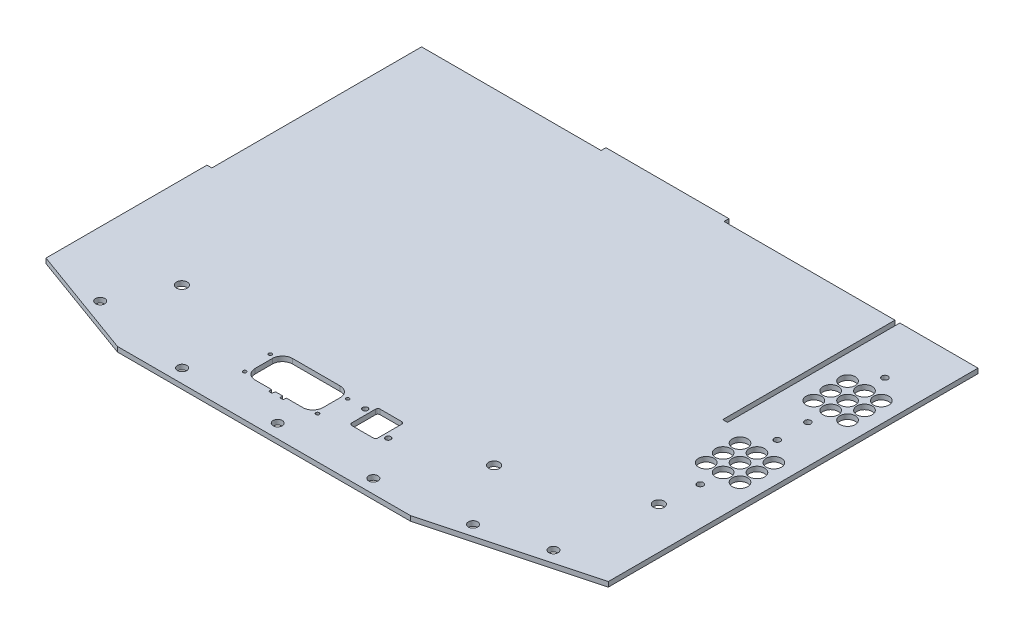
from build123d import *

# Parameters (mm, degrees)
SKETCH1_W                 = 308.11216
SKETCH1_H                 = 3.175
BOSS_EXTRUDE1_DEPTH       = 267.83
SKETCH3_W                 = 155.702
SKETCH3_H                 = 3.175
BOSS_EXTRUDE3_DEPTH       = 3.175
SKETCH4_W                 = 50.87366
SKETCH4_H                 = 3.175
BOSS_EXTRUDE4_DEPTH       = 267.83
CUT_EXTRUDE1_DEPTH        = 340.191055801
CUT_EXTRUDE3_DEPTH        = 340.191055801
SKETCH19_R                = 5
CUT_EXTRUDE5_DEPTH        = 340.191055801
LPATTERN1_COUNT           = 3
LPATTERN1_PITCH           = 11
LPATTERN2_COUNT           = 3
LPATTERN2_PITCH           = 11
LPATTERN2_COPY_1_SKETCH_R = 5
LPATTERN2_COPY_1_DEPTH    = 340.191055801
LPATTERN2_COPY_2_SKETCH_R = 5
LPATTERN2_COPY_2_DEPTH    = 340.191055801
LPATTERN2_COPY_3_SKETCH_R = 5
LPATTERN2_COPY_3_DEPTH    = 340.191055801
LPATTERN2_COPY_4_SKETCH_R = 5
LPATTERN2_COPY_4_DEPTH    = 340.191055801
LPATTERN3_COUNT           = 2
LPATTERN3_PITCH           = 69.999939878
LPATTERN3_COPY_1_SKETCH_R = 5
LPATTERN3_COPY_1_DEPTH    = 340.191055801
LPATTERN3_COPY_2_SKETCH_R = 5
LPATTERN3_COPY_2_DEPTH    = 340.191055801
LPATTERN3_COPY_3_SKETCH_R = 5
LPATTERN3_COPY_3_DEPTH    = 340.191055801
LPATTERN3_COPY_4_SKETCH_R = 5
LPATTERN3_COPY_4_DEPTH    = 340.191055801
LPATTERN3_COPY_5_SKETCH_R = 5
LPATTERN3_COPY_5_DEPTH    = 340.191055801
LPATTERN3_COPY_6_SKETCH_R = 5
LPATTERN3_COPY_6_DEPTH    = 340.191055801
LPATTERN3_COPY_7_SKETCH_R = 5
LPATTERN3_COPY_7_DEPTH    = 340.191055801
LPATTERN3_COPY_8_SKETCH_R = 5
LPATTERN3_COPY_8_DEPTH    = 340.191055801
SKETCH21_W                = 105.9343525
SKETCH21_H                = 3.175
BOSS_EXTRUDE5_DEPTH       = 3.175
CUT_EXTRUDE9_DEPTH        = 340.191055801
CUT_EXTRUDE9_DEPTH_BACK   = 340.191055801
CUT_EXTRUDE11_DEPTH       = 340.191055801
CUT_EXTRUDE11_DEPTH_BACK  = 80.645
SKETCH32_R                = 3
M6_CLEARANCE_HOLE1_D      = 7
M6_CLEARANCE_HOLE2_D      = 7
CUT_EXTRUDE12_DEPTH       = 340.191055801
M3_CLEARANCE_HOLE1_D      = 3.4
SKETCH42_R                = 2
CUT_EXTRUDE13_DEPTH       = 340.191055942
SKETCH43_W                = 80
SKETCH43_H                = 3.175
BOSS_EXTRUDE6_DEPTH       = 3.175


with BuildPart() as part:
    # Sketch1 → Boss-Extrude1 (new body)
    with BuildSketch(Plane.XY):
        Rectangle(SKETCH1_W, SKETCH1_H)
    extrude(amount=BOSS_EXTRUDE1_DEPTH)

    # Sketch3 → Boss-Extrude3 (add)
    with BuildSketch(Plane(origin=(154.05608, 0, 0), x_dir=(0, 0, -1), z_dir=(1, 0, 0))):
        with Locations((-189.979, 0)):
            Rectangle(SKETCH3_W, SKETCH3_H)
    extrude(amount=BOSS_EXTRUDE3_DEPTH)

    # Sketch4 → Boss-Extrude4 (add)
    with BuildSketch(Plane.XY.offset(267.83)):
        with Locations((182.66791, 0)):
            Rectangle(SKETCH4_W, SKETCH4_H)
    extrude(amount=-BOSS_EXTRUDE4_DEPTH)

    # Sketch6 → Cut-Extrude1 (cut, through all)
    with BuildSketch(Plane(origin=(0, 1.5875, 0), x_dir=(1, 0, 0), z_dir=(0, 1, 0))):
        Polygon((208.10474, -240.606362049), (106.50474, -267.83), (208.10474, -267.83), align=None)
    extrude(amount=-CUT_EXTRUDE1_DEPTH, mode=Mode.SUBTRACT)

    # Sketch11 → Cut-Extrude3 (cut, through all)
    with BuildSketch(Plane.XZ.offset(1.5875)):
        Polygon((-154.05608, 242.43), (-84.20608, 267.83), (-154.05608, 267.83), align=None)
    extrude(amount=-CUT_EXTRUDE3_DEPTH, mode=Mode.SUBTRACT)

    # Sketch19 → Cut-Extrude5 (cut, through all)
    with BuildSketch(Plane(origin=(0, 1.5875, 0), x_dir=(1, 0, 0), z_dir=(0, 1, 0))):
        with Locations(Location((172.98674, -49.774823778, 0), (0, 0, 270))):
            Circle(SKETCH19_R)
    cut_extrude5 = extrude(amount=-CUT_EXTRUDE5_DEPTH, mode=Mode.SUBTRACT)

    # LPattern1: Cut-Extrude5 ×3
    with Locations(*[(i * LPATTERN1_PITCH, 0, 0) for i in range(1, LPATTERN1_COUNT)]):
        add(cut_extrude5, mode=Mode.SUBTRACT)

    # LPattern2: Cut-Extrude5 ×3
    with Locations(*[(0, 0, i * LPATTERN2_PITCH) for i in range(1, LPATTERN2_COUNT)]):
        add(cut_extrude5, mode=Mode.SUBTRACT)

    # LPattern2 copy 1 sketch → LPattern2 copy 1 (cut, through all)
    with BuildSketch(Plane(origin=(11, 1.5875, 11), x_dir=(1, 0, 0), z_dir=(0, 1, 0))):
        with Locations(Location((172.98674, -49.774823778, 0), (0, 0, 270))):
            Circle(LPATTERN2_COPY_1_SKETCH_R)
    extrude(amount=-LPATTERN2_COPY_1_DEPTH, mode=Mode.SUBTRACT)

    # LPattern2 copy 2 sketch → LPattern2 copy 2 (cut, through all)
    with BuildSketch(Plane(origin=(11, 1.5875, 22), x_dir=(1, 0, 0), z_dir=(0, 1, 0))):
        with Locations(Location((172.98674, -49.774823778, 0), (0, 0, 270))):
            Circle(LPATTERN2_COPY_2_SKETCH_R)
    extrude(amount=-LPATTERN2_COPY_2_DEPTH, mode=Mode.SUBTRACT)

    # LPattern2 copy 3 sketch → LPattern2 copy 3 (cut, through all)
    with BuildSketch(Plane(origin=(22, 1.5875, 11), x_dir=(1, 0, 0), z_dir=(0, 1, 0))):
        with Locations(Location((172.98674, -49.774823778, 0), (0, 0, 270))):
            Circle(LPATTERN2_COPY_3_SKETCH_R)
    extrude(amount=-LPATTERN2_COPY_3_DEPTH, mode=Mode.SUBTRACT)

    # LPattern2 copy 4 sketch → LPattern2 copy 4 (cut, through all)
    with BuildSketch(Plane(origin=(22, 1.5875, 22), x_dir=(1, 0, 0), z_dir=(0, 1, 0))):
        with Locations(Location((172.98674, -49.774823778, 0), (0, 0, 270))):
            Circle(LPATTERN2_COPY_4_SKETCH_R)
    extrude(amount=-LPATTERN2_COPY_4_DEPTH, mode=Mode.SUBTRACT)

    # LPattern3: Cut-Extrude5 ×2
    with Locations(*[(0, 0, i * LPATTERN3_PITCH) for i in range(1, LPATTERN3_COUNT)]):
        add(cut_extrude5, mode=Mode.SUBTRACT)

    # LPattern3 copy 1 sketch → LPattern3 copy 1 (cut, through all)
    with BuildSketch(Plane(origin=(11, 1.5875, 69.999939878), x_dir=(1, 0, 0), z_dir=(0, 1, 0))):
        with Locations(Location((172.98674, -49.774823778, 0), (0, 0, 270))):
            Circle(LPATTERN3_COPY_1_SKETCH_R)
    extrude(amount=-LPATTERN3_COPY_1_DEPTH, mode=Mode.SUBTRACT)

    # LPattern3 copy 2 sketch → LPattern3 copy 2 (cut, through all)
    with BuildSketch(Plane(origin=(22, 1.5875, 69.999939878), x_dir=(1, 0, 0), z_dir=(0, 1, 0))):
        with Locations(Location((172.98674, -49.774823778, 0), (0, 0, 270))):
            Circle(LPATTERN3_COPY_2_SKETCH_R)
    extrude(amount=-LPATTERN3_COPY_2_DEPTH, mode=Mode.SUBTRACT)

    # LPattern3 copy 3 sketch → LPattern3 copy 3 (cut, through all)
    with BuildSketch(Plane(origin=(0, 1.5875, 80.999939878), x_dir=(1, 0, 0), z_dir=(0, 1, 0))):
        with Locations(Location((172.98674, -49.774823778, 0), (0, 0, 270))):
            Circle(LPATTERN3_COPY_3_SKETCH_R)
    extrude(amount=-LPATTERN3_COPY_3_DEPTH, mode=Mode.SUBTRACT)

    # LPattern3 copy 4 sketch → LPattern3 copy 4 (cut, through all)
    with BuildSketch(Plane(origin=(0, 1.5875, 91.999939878), x_dir=(1, 0, 0), z_dir=(0, 1, 0))):
        with Locations(Location((172.98674, -49.774823778, 0), (0, 0, 270))):
            Circle(LPATTERN3_COPY_4_SKETCH_R)
    extrude(amount=-LPATTERN3_COPY_4_DEPTH, mode=Mode.SUBTRACT)

    # LPattern3 copy 5 sketch → LPattern3 copy 5 (cut, through all)
    with BuildSketch(Plane(origin=(11, 1.5875, 80.999939878), x_dir=(1, 0, 0), z_dir=(0, 1, 0))):
        with Locations(Location((172.98674, -49.774823778, 0), (0, 0, 270))):
            Circle(LPATTERN3_COPY_5_SKETCH_R)
    extrude(amount=-LPATTERN3_COPY_5_DEPTH, mode=Mode.SUBTRACT)

    # LPattern3 copy 6 sketch → LPattern3 copy 6 (cut, through all)
    with BuildSketch(Plane(origin=(11, 1.5875, 91.999939878), x_dir=(1, 0, 0), z_dir=(0, 1, 0))):
        with Locations(Location((172.98674, -49.774823778, 0), (0, 0, 270))):
            Circle(LPATTERN3_COPY_6_SKETCH_R)
    extrude(amount=-LPATTERN3_COPY_6_DEPTH, mode=Mode.SUBTRACT)

    # LPattern3 copy 7 sketch → LPattern3 copy 7 (cut, through all)
    with BuildSketch(Plane(origin=(22, 1.5875, 80.999939878), x_dir=(1, 0, 0), z_dir=(0, 1, 0))):
        with Locations(Location((172.98674, -49.774823778, 0), (0, 0, 270))):
            Circle(LPATTERN3_COPY_7_SKETCH_R)
    extrude(amount=-LPATTERN3_COPY_7_DEPTH, mode=Mode.SUBTRACT)

    # LPattern3 copy 8 sketch → LPattern3 copy 8 (cut, through all)
    with BuildSketch(Plane(origin=(22, 1.5875, 91.999939878), x_dir=(1, 0, 0), z_dir=(0, 1, 0))):
        with Locations(Location((172.98674, -49.774823778, 0), (0, 0, 270))):
            Circle(LPATTERN3_COPY_8_SKETCH_R)
    extrude(amount=-LPATTERN3_COPY_8_DEPTH, mode=Mode.SUBTRACT)

    # Sketch21 → Boss-Extrude5 (add)
    with BuildSketch(Plane.ZY.offset(154.05608)):
        with Locations((189.46282375, 0)):
            Rectangle(SKETCH21_W, SKETCH21_H)
    extrude(amount=BOSS_EXTRUDE5_DEPTH)

    # Sketch27 → Cut-Extrude9 (cut, two sides: drawn at the far end of the back side and taken through both)
    with BuildSketch(Plane(origin=(0, 1.5875, 0), x_dir=(1, 0, 0), z_dir=(0, 1, 0)).offset(-CUT_EXTRUDE9_DEPTH_BACK)):
        Polygon((748.107746333, -570.489573212), (-84.20608, -267.83), (-154.05608, -242.43), (-157.23108, -241.275454545), (-989.544906333, 61.384118666), (-1594.864052757, -1603.243534), (142.788599909, -2235.117225879), align=None)
    extrude(amount=CUT_EXTRUDE9_DEPTH + CUT_EXTRUDE9_DEPTH_BACK, mode=Mode.SUBTRACT)

    # Sketch32 → Cut-Extrude11 (cut, two sides: drawn at the far end of the back side and taken through both)
    with BuildSketch(Plane(origin=(0, 1.5875, 0), x_dir=(1, 0, 0), z_dir=(0, 1, 0)).offset(-CUT_EXTRUDE11_DEPTH_BACK)):
        with Locations(Location((172.54426, -240.761310541, 0), (0, 0, 90))):
            Circle(SKETCH32_R)
        with Locations(Location((131.90426, -252.445254824, 0), (0, 0, 90))):
            Circle(SKETCH32_R)
        with Locations(Location((73.48426, -258.94, 0), (0, 0, 90))):
            Circle(SKETCH32_R)
        with Locations(Location((11.25426, -258.94, 0), (0, 0, 90))):
            Circle(SKETCH32_R)
        with Locations(Location((-50.97574, -258.94, 0), (0, 0, 90))):
            Circle(SKETCH32_R)
        with Locations(Location((-115.3206, -247.915394364, 0), (0, 0, 90))):
            Circle(SKETCH32_R)
    extrude(amount=CUT_EXTRUDE11_DEPTH + CUT_EXTRUDE11_DEPTH_BACK, mode=Mode.SUBTRACT)

    # M6 Clearance Hole1 (through all)
    with Locations(Plane(origin=(0, 1.5875, 0), x_dir=(1, 0, 0), z_dir=(0, 1, 0))):
        with Locations((180.96500002, -180.586)):
            Hole(M6_CLEARANCE_HOLE1_D / 2)

    # M6 Clearance Hole2 (through all)
    with Locations(Plane(origin=(0, 1.5875, 0), x_dir=(1, 0, 0), z_dir=(0, 1, 0))):
        with Locations((105.42905, -212.2849914), (-97.77095, -212.2849914)):
            Hole(M6_CLEARANCE_HOLE2_D / 2)

    # Sketch36 → Cut-Extrude12 (cut, through all)
    # profile 1 of 11: a face of its own
    with BuildSketch(Plane(origin=(0, 1.5875, 0), x_dir=(1, 0, 0), z_dir=(0, 1, 0))):
        with BuildLine():
            Line((-0.218637999, -243.976806196), (-0.043660718, -241.976806026))
            Line((-0.043660718, -241.976806026), (10.607217094, -241.976806026))
            ThreePointArc((10.607217094, -241.976806026), (15.260686821, -240.049275753), (17.188217094, -235.395806026))
            Line((17.188217094, -235.395806026), (17.188217094, -224.195806026))
            ThreePointArc((17.188217094, -224.195806026), (15.260686821, -219.542336299), (10.607217094, -217.614806026))
            Line((10.607217094, -217.614806026), (-20.392782906, -217.614806026))
            ThreePointArc((-20.392782906, -217.614806026), (-25.046252633, -219.542336299), (-26.973782906, -224.195806026))
            Line((-26.973782906, -224.195806026), (-26.973782906, -235.395806026))
            ThreePointArc((-26.973782906, -235.395806026), (-25.046252633, -240.049275753), (-20.392782906, -241.976806026))
            Line((-20.392782906, -241.976806026), (-9.741905078, -241.976806026))
            Line((-9.741905078, -241.976806026), (-9.566927704, -243.976806196))
            Line((-9.566927704, -243.976806196), (-7.418637999, -243.976806196))
            Line((-7.418637999, -243.976806196), (-7.243660718, -241.976806026))
            Line((-7.243660718, -241.976806026), (-2.541905078, -241.976806026))
            Line((-2.541905078, -241.976806026), (-2.366927704, -243.976806196))
            Line((-2.366927704, -243.976806196), (-0.218637999, -243.976806196))
        make_face()
        with BuildLine():
            Line((10.607217094, -241.595806026), (-0.392782906, -241.595806026))
            Line((-0.392782906, -241.595806026), (-0.567760187, -243.595806196))
            Line((-0.567760187, -243.595806196), (-2.017805533, -243.595806196))
            Line((-2.017805533, -243.595806196), (-2.192782906, -241.595806026))
            Line((-2.192782906, -241.595806026), (-7.592782906, -241.595806026))
            Line((-7.592782906, -241.595806026), (-7.767760187, -243.595806196))
            Line((-7.767760187, -243.595806196), (-9.217805533, -243.595806196))
            Line((-9.217805533, -243.595806196), (-9.392782906, -241.595806026))
            Line((-9.392782906, -241.595806026), (-20.392782906, -241.595806026))
            ThreePointArc((-20.392782906, -241.595806026), (-24.77684495, -239.779868069), (-26.592782906, -235.395806026))
            Line((-26.592782906, -235.395806026), (-26.592782906, -224.195806026))
            ThreePointArc((-26.592782906, -224.195806026), (-24.77684495, -219.811743982), (-20.392782906, -217.995806026))
            Line((-20.392782906, -217.995806026), (10.607217094, -217.995806026))
            ThreePointArc((10.607217094, -217.995806026), (14.991279137, -219.811743982), (16.807217094, -224.195806026))
            Line((16.807217094, -224.195806026), (16.807217094, -235.395806026))
            ThreePointArc((16.807217094, -235.395806026), (14.991279137, -239.779868069), (10.607217094, -241.595806026))
        make_face(mode=Mode.SUBTRACT)
    # profile 2 of 11: a face of its own
    with BuildSketch(Plane(origin=(0, 1.5875, 0), x_dir=(1, 0, 0), z_dir=(0, 1, 0))):
        Polygon((-7.767760187, -243.595806196), (-7.592782906, -241.595806026), (-9.392782906, -241.595806026), (-9.217805533, -243.595806196), align=None)
    # profile 3 of 11: a face of its own
    with BuildSketch(Plane(origin=(0, 1.5875, 0), x_dir=(1, 0, 0), z_dir=(0, 1, 0))):
        Polygon((-0.567760187, -243.595806196), (-0.392782906, -241.595806026), (-2.192782906, -241.595806026), (-2.017805533, -243.595806196), align=None)
    # profile 4 of 11: a face of its own
    with BuildSketch(Plane(origin=(0, 1.5875, 0), x_dir=(1, 0, 0), z_dir=(0, 1, 0))):
        with BuildLine():
            Line((-2.192782906, -241.595806026), (-0.392782906, -241.595806026))
            Line((-0.392782906, -241.595806026), (10.607217094, -241.595806026))
            ThreePointArc((10.607217094, -241.595806026), (14.991279137, -239.779868069), (16.807217094, -235.395806026))
            Line((16.807217094, -235.395806026), (16.807217094, -224.195806026))
            ThreePointArc((16.807217094, -224.195806026), (14.991279137, -219.811743982), (10.607217094, -217.995806026))
            Line((10.607217094, -217.995806026), (-20.392782906, -217.995806026))
            ThreePointArc((-20.392782906, -217.995806026), (-24.77684495, -219.811743982), (-26.592782906, -224.195806026))
            Line((-26.592782906, -224.195806026), (-26.592782906, -235.395806026))
            ThreePointArc((-26.592782906, -235.395806026), (-24.77684495, -239.779868069), (-20.392782906, -241.595806026))
            Line((-20.392782906, -241.595806026), (-9.392782906, -241.595806026))
            Line((-9.392782906, -241.595806026), (-7.592782906, -241.595806026))
            Line((-7.592782906, -241.595806026), (-2.192782906, -241.595806026))
        make_face()
    # profile 5 of 11: a face of its own
    with BuildSketch(Plane(origin=(0, 1.5875, 0), x_dir=(1, 0, 0), z_dir=(0, 1, 0))):
        with BuildLine():
            add(Edge.make_bspline(
                [(50.704288123, -236.196811977), (50.889280377, -236.196811977), (51.251028279, -236.133180028), (51.784098786, -235.795622639), (52.121656175, -235.262552133), (52.185288123, -234.90080423), (52.185288123, -234.715811977)],
                knots=[0, 0, 0, 0, 0.25, 0.5, 0.75, 1, 1, 1, 1], degree=3))
            Line((52.185288123, -234.715811977), (52.185288123, -219.165811977))
            add(Edge.make_bspline(
                [(52.185288123, -219.165811977), (52.185288123, -218.980819723), (52.121656175, -218.619071821), (51.784098786, -218.086001314), (51.251028279, -217.748443925), (50.889280377, -217.684811977), (50.704288123, -217.684811977)],
                knots=[0, 0, 0, 0, 0.25, 0.5, 0.75, 1, 1, 1, 1], degree=3))
            Line((50.704288123, -217.684811977), (36.654288123, -217.684811977))
            add(Edge.make_bspline(
                [(36.654288123, -217.684811977), (36.46929587, -217.684811977), (36.107547967, -217.748443925), (35.574477461, -218.086001314), (35.236920072, -218.619071821), (35.173288123, -218.980819723), (35.173288123, -219.165811977)],
                knots=[0, 0, 0, 0, 0.25, 0.5, 0.75, 1, 1, 1, 1], degree=3))
            Line((35.173288123, -219.165811977), (35.173288123, -234.715811977))
            add(Edge.make_bspline(
                [(35.173288123, -234.715811977), (35.173288123, -234.90080423), (35.236920072, -235.262552133), (35.574477461, -235.795622639), (36.107547967, -236.133180028), (36.46929587, -236.196811977), (36.654288123, -236.196811977)],
                knots=[0, 0, 0, 0, 0.25, 0.5, 0.75, 1, 1, 1, 1], degree=3))
            Line((36.654288123, -236.196811977), (50.704288123, -236.196811977))
        make_face()
        with BuildLine():
            Line((36.654288123, -218.065811977), (50.704288123, -218.065811977))
            add(Edge.make_bspline(
                [(51.804288123, -219.165811977), (51.804288123, -218.521446895), (51.348653205, -218.065811977), (50.704288123, -218.065811977)],
                knots=[0, 0, 0, 0, 1, 1, 1, 1], degree=3, weights=[1, 0.804737854, 0.804737854, 1]))
            Line((51.804288123, -219.165811977), (51.804288123, -234.715811977))
            add(Edge.make_bspline(
                [(50.704288123, -235.815811977), (51.348653205, -235.815811977), (51.804288123, -235.360177058), (51.804288123, -234.715811977)],
                knots=[0, 0, 0, 0, 1, 1, 1, 1], degree=3, weights=[1, 0.804737854, 0.804737854, 1]))
            Line((50.704288123, -235.815811977), (36.654288123, -235.815811977))
            add(Edge.make_bspline(
                [(35.554288123, -234.715811977), (35.554288123, -235.360177058), (36.009923042, -235.815811977), (36.654288123, -235.815811977)],
                knots=[0, 0, 0, 0, 1, 1, 1, 1], degree=3, weights=[1, 0.804737854, 0.804737854, 1]))
            Line((35.554288123, -234.715811977), (35.554288123, -219.165811977))
            add(Edge.make_bspline(
                [(36.654288123, -218.065811977), (36.009923042, -218.065811977), (35.554288123, -218.521446895), (35.554288123, -219.165811977)],
                knots=[0, 0, 0, 0, 1, 1, 1, 1], degree=3, weights=[1, 0.804737854, 0.804737854, 1]))
        make_face(mode=Mode.SUBTRACT)
    # profile 6 of 11: a face of its own
    with BuildSketch(Plane(origin=(0, 1.5875, 0), x_dir=(1, 0, 0), z_dir=(0, 1, 0))):
        with BuildLine():
            add(Edge.make_bspline(
                [(51.804288123, -219.165811977), (51.804288123, -218.521446895), (51.348653205, -218.065811977), (50.704288123, -218.065811977)],
                knots=[0, 0, 0, 0, 1, 1, 1, 1], degree=3, weights=[1, 0.804737854, 0.804737854, 1]))
            Line((50.704288123, -218.065811977), (36.654288123, -218.065811977))
            add(Edge.make_bspline(
                [(36.654288123, -218.065811977), (36.009923042, -218.065811977), (35.554288123, -218.521446895), (35.554288123, -219.165811977)],
                knots=[0, 0, 0, 0, 1, 1, 1, 1], degree=3, weights=[1, 0.804737854, 0.804737854, 1]))
            Line((35.554288123, -219.165811977), (35.554288123, -234.715811977))
            add(Edge.make_bspline(
                [(35.554288123, -234.715811977), (35.554288123, -235.360177058), (36.009923042, -235.815811977), (36.654288123, -235.815811977)],
                knots=[0, 0, 0, 0, 1, 1, 1, 1], degree=3, weights=[1, 0.804737854, 0.804737854, 1]))
            Line((36.654288123, -235.815811977), (50.704288123, -235.815811977))
            add(Edge.make_bspline(
                [(50.704288123, -235.815811977), (51.348653205, -235.815811977), (51.804288123, -235.360177058), (51.804288123, -234.715811977)],
                knots=[0, 0, 0, 0, 1, 1, 1, 1], degree=3, weights=[1, 0.804737854, 0.804737854, 1]))
            Line((51.804288123, -234.715811977), (51.804288123, -219.165811977))
        make_face()
        with BuildLine():
            add(Edge.make_bspline(
                [(36.204288116, -219.165811977), (36.204288116, -218.90220808), (36.390684219, -218.715811977), (36.654288116, -218.715811977)],
                knots=[0, 0, 0, 0, 1, 1, 1, 1], degree=3, weights=[1, 0.804737854, 0.804737854, 1]))
            Line((36.654288116, -218.715811977), (50.704288116, -218.715811977))
            add(Edge.make_bspline(
                [(50.704288116, -218.715811977), (50.967892012, -218.715811977), (51.154288116, -218.90220808), (51.154288116, -219.165811977)],
                knots=[0, 0, 0, 0, 1, 1, 1, 1], degree=3, weights=[1, 0.804737854, 0.804737854, 1]))
            Line((51.154288116, -219.165811977), (51.154288116, -234.715811977))
            add(Edge.make_bspline(
                [(51.154288116, -234.715811977), (51.154288116, -234.979415874), (50.967892012, -235.165811977), (50.704288116, -235.165811977)],
                knots=[0, 0, 0, 0, 1, 1, 1, 1], degree=3, weights=[1, 0.804737854, 0.804737854, 1]))
            Line((50.704288116, -235.165811977), (36.654288116, -235.165811977))
            add(Edge.make_bspline(
                [(36.654288116, -235.165811977), (36.390684219, -235.165811977), (36.204288116, -234.979415874), (36.204288116, -234.715811977)],
                knots=[0, 0, 0, 0, 1, 1, 1, 1], degree=3, weights=[1, 0.804737854, 0.804737854, 1]))
            Line((36.204288116, -234.715811977), (36.204288116, -219.165811977))
        make_face(mode=Mode.SUBTRACT)
    # profile 7 of 11: a face of its own
    with BuildSketch(Plane(origin=(0, 1.5875, 0), x_dir=(1, 0, 0), z_dir=(0, 1, 0))):
        with BuildLine():
            Line((50.704288116, -218.715811977), (36.654288116, -218.715811977))
            add(Edge.make_bspline(
                [(36.204288116, -219.165811977), (36.204288116, -218.90220808), (36.390684219, -218.715811977), (36.654288116, -218.715811977)],
                knots=[0, 0, 0, 0, 1, 1, 1, 1], degree=3, weights=[1, 0.804737854, 0.804737854, 1]))
            Line((36.204288116, -219.165811977), (36.204288116, -234.715811977))
            add(Edge.make_bspline(
                [(36.654288116, -235.165811977), (36.390684219, -235.165811977), (36.204288116, -234.979415874), (36.204288116, -234.715811977)],
                knots=[0, 0, 0, 0, 1, 1, 1, 1], degree=3, weights=[1, 0.804737854, 0.804737854, 1]))
            Line((36.654288116, -235.165811977), (50.704288116, -235.165811977))
            add(Edge.make_bspline(
                [(51.154288116, -234.715811977), (51.154288116, -234.979415874), (50.967892012, -235.165811977), (50.704288116, -235.165811977)],
                knots=[0, 0, 0, 0, 1, 1, 1, 1], degree=3, weights=[1, 0.804737854, 0.804737854, 1]))
            Line((51.154288116, -234.715811977), (51.154288116, -219.165811977))
            add(Edge.make_bspline(
                [(50.704288116, -218.715811977), (50.967892012, -218.715811977), (51.154288116, -218.90220808), (51.154288116, -219.165811977)],
                knots=[0, 0, 0, 0, 1, 1, 1, 1], degree=3, weights=[1, 0.804737854, 0.804737854, 1]))
        make_face()
    # profile 8 of 11: a face of its own
    with BuildSketch(Plane(origin=(0, 1.5875, 0), x_dir=(1, 0, 0), z_dir=(0, 1, 0))):
        with BuildLine():
            add(Edge.make_bspline(
                [(19.892217324, -240.595806868), (19.892217324, -242.765806868), (17.722217324, -242.765806868), (17.722217324, -240.595806868)],
                knots=[0, 0, 0, 0, 1, 1, 1, 1], degree=3, weights=[1, 0.333333333, 0.333333333, 1]))
            add(Edge.make_bspline(
                [(17.722217324, -240.595806868), (17.722217324, -238.425806868), (19.892217324, -238.425806868), (19.892217324, -240.595806868)],
                knots=[0, 0, 0, 0, 1, 1, 1, 1], degree=3, weights=[1, 0.333333333, 0.333333333, 1]))
        make_face()
    # profile 9 of 11: a face of its own
    with BuildSketch(Plane(origin=(0, 1.5875, 0), x_dir=(1, 0, 0), z_dir=(0, 1, 0))):
        with BuildLine():
            add(Edge.make_bspline(
                [(21.392217324, -222.495806868), (21.392217324, -224.665806868), (19.222217324, -224.665806868), (19.222217324, -222.495806868)],
                knots=[0, 0, 0, 0, 1, 1, 1, 1], degree=3, weights=[1, 0.333333333, 0.333333333, 1]))
            add(Edge.make_bspline(
                [(19.222217324, -222.495806868), (19.222217324, -220.325806868), (21.392217324, -220.325806868), (21.392217324, -222.495806868)],
                knots=[0, 0, 0, 0, 1, 1, 1, 1], degree=3, weights=[1, 0.333333333, 0.333333333, 1]))
        make_face()
    # profile 10 of 11: a face of its own
    with BuildSketch(Plane(origin=(0, 1.5875, 0), x_dir=(1, 0, 0), z_dir=(0, 1, 0))):
        with BuildLine():
            add(Edge.make_bspline(
                [(-29.007782676, -222.495806868), (-29.007782676, -224.665806868), (-31.177782676, -224.665806868), (-31.177782676, -222.495806868)],
                knots=[0, 0, 0, 0, 1, 1, 1, 1], degree=3, weights=[1, 0.333333333, 0.333333333, 1]))
            add(Edge.make_bspline(
                [(-31.177782676, -222.495806868), (-31.177782676, -220.325806868), (-29.007782676, -220.325806868), (-29.007782676, -222.495806868)],
                knots=[0, 0, 0, 0, 1, 1, 1, 1], degree=3, weights=[1, 0.333333333, 0.333333333, 1]))
        make_face()
    # profile 11 of 11: a face of its own
    with BuildSketch(Plane(origin=(0, 1.5875, 0), x_dir=(1, 0, 0), z_dir=(0, 1, 0))):
        with BuildLine():
            add(Edge.make_bspline(
                [(-27.507782676, -240.595806868), (-27.507782676, -242.765806868), (-29.677782676, -242.765806868), (-29.677782676, -240.595806868)],
                knots=[0, 0, 0, 0, 1, 1, 1, 1], degree=3, weights=[1, 0.333333333, 0.333333333, 1]))
            add(Edge.make_bspline(
                [(-29.677782676, -240.595806868), (-29.677782676, -238.425806868), (-27.507782676, -238.425806868), (-27.507782676, -240.595806868)],
                knots=[0, 0, 0, 0, 1, 1, 1, 1], degree=3, weights=[1, 0.333333333, 0.333333333, 1]))
        make_face()
    extrude(amount=-CUT_EXTRUDE12_DEPTH, mode=Mode.SUBTRACT)

    # M3 Clearance Hole1 (through all)
    with Locations(Plane(origin=(0, 1.5875, 0), x_dir=(1, 0, 0), z_dir=(0, 1, 0))):
        with Locations((55.679288258, -231.440811977), (31.679288258, -222.440811977)):
            Hole(M3_CLEARANCE_HOLE1_D / 2)

    # Sketch42 → Cut-Extrude13 (cut, through all)
    with BuildSketch(Plane(origin=(0, 1.5875, 0), x_dir=(1, 0, 0), z_dir=(0, 1, 0))):
        with Locations(Location((183.21574, -85.885622825, 0), (0, 0, 270))):
            Circle(SKETCH42_R)
        with Locations(Location((183.21574, -35.764377175, 0), (0, 0, 270))):
            Circle(SKETCH42_R)
        with Locations(Location((183.21574, -155.885622825, 0), (0, 0, 270))):
            Circle(SKETCH42_R)
        with Locations(Location((183.21574, -105.764377175, 0), (0, 0, 270))):
            Circle(SKETCH42_R)
    extrude(amount=-CUT_EXTRUDE13_DEPTH, mode=Mode.SUBTRACT)

    # Sketch43 → Boss-Extrude6 (add)
    with BuildSketch(Plane(origin=(0, 0, 0), x_dir=(-1, 0, 0), z_dir=(0, 0, -1))):
        with Locations((-2.78399998, 0)):
            Rectangle(SKETCH43_W, SKETCH43_H)
    extrude(amount=BOSS_EXTRUDE6_DEPTH)


solid = part.part
